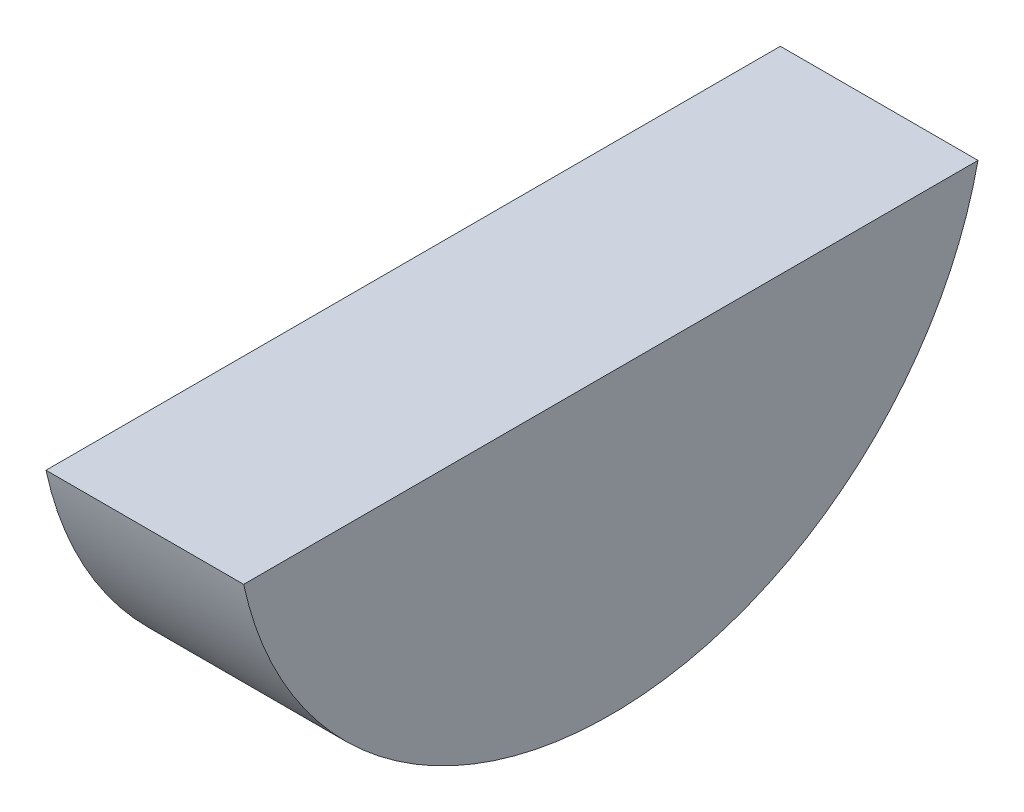
from build123d import *

# Parameters (mm, degrees)
EXTRUDE_1_DEPTH = 5


with BuildPart() as part:
    # Эскиз1 → Бобышка-Вытянуть1 (new body)
    with BuildSketch(Plane(origin=(0, 0, 0), x_dir=(0, 0, -1), z_dir=(1, 0, 0))):
        with BuildLine():
            Line((-9.287087811, 7.5), (9.287087811, 7.5))
            ThreePointArc((9.287087811, 7.5), (0, 0), (-9.287087811, 7.5))
        make_face()
    extrude(amount=EXTRUDE_1_DEPTH)


solid = part.part
